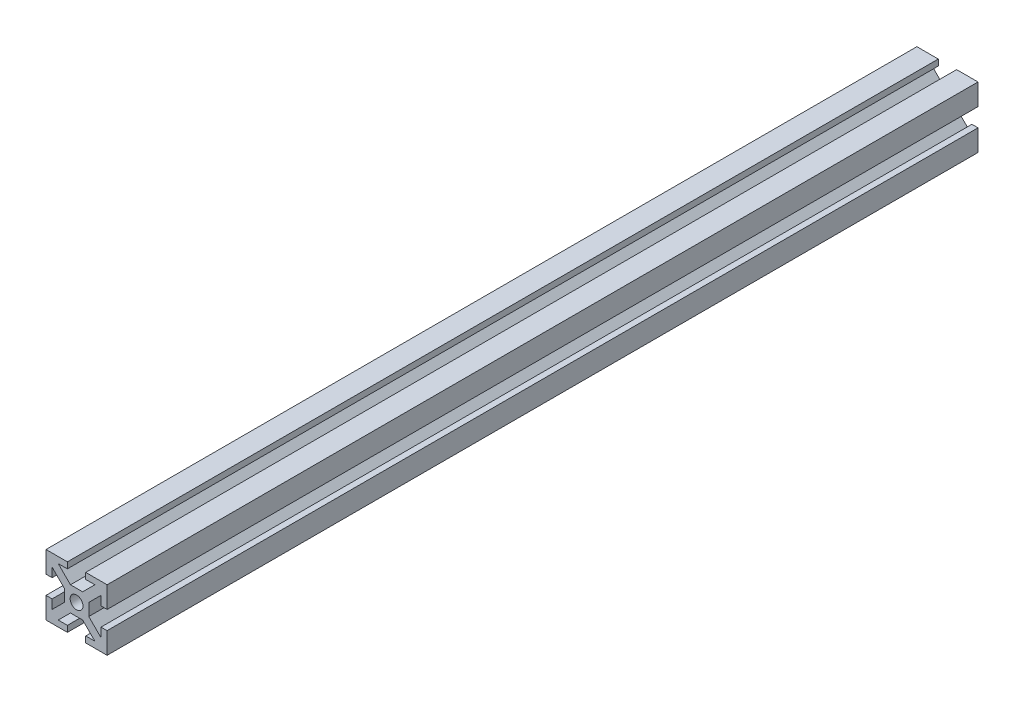
from build123d import *

# Parameters (mm, degrees)
SKETCH1_W           = 8
SKETCH1_H           = 8
SKETCH1_R           = 2.1
BOSS_EXTRUDE1_DEPTH = 285


with BuildPart() as part:
    # Sketch1 → Boss-Extrude1 (new body)
    # profile 1 of 5: a face of its own
    with BuildSketch(Plane.XY):
        Polygon((2, 16), (6, 12), (6, 14), (8, 14), (4, 18), (7, 18), (7, 20), (0, 20), (0, 13), (2, 13), align=None)
    # profile 2 of 5: a face of its own
    with BuildSketch(Plane.XY):
        Polygon((16, 18), (12, 14), (14, 14), (14, 12), (18, 16), (18, 13), (20, 13), (20, 20), (13, 20), (13, 18), align=None)
    # profile 3 of 5: a face of its own
    with BuildSketch(Plane.XY):
        with Locations((10, 10)):
            Rectangle(SKETCH1_W, SKETCH1_H)
        with Locations((10, 10)):
            Circle(SKETCH1_R, mode=Mode.SUBTRACT)
    # profile 4 of 5: a face of its own
    with BuildSketch(Plane.XY):
        Polygon((6, 8), (2, 4), (2, 7), (0, 7), (0, 0), (7, 0), (7, 2), (4, 2), (8, 6), (6, 6), align=None)
    # profile 5 of 5: a face of its own
    with BuildSketch(Plane.XY):
        Polygon((14, 6), (12, 6), (16, 2), (13, 2), (13, 0), (20, 0), (20, 7), (18, 7), (18, 4), (14, 8), align=None)
    extrude(amount=BOSS_EXTRUDE1_DEPTH)


solid = part.part
